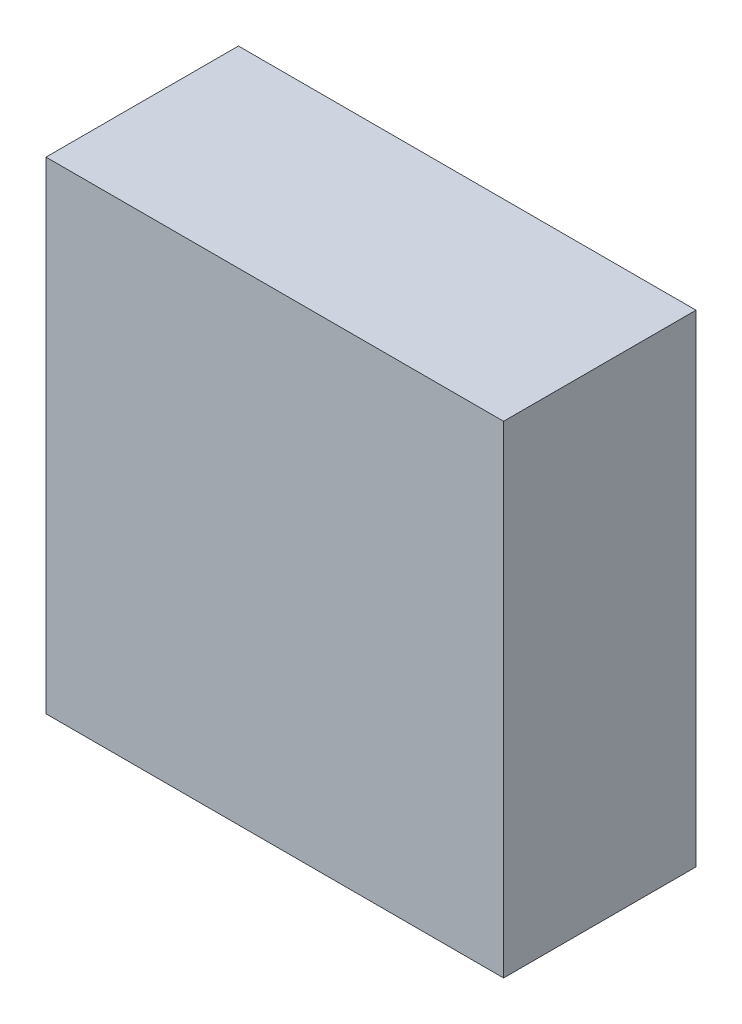
from build123d import *

# Parameters (mm, degrees)
SKETCH1_W               = 9.3955108
SKETCH1_H               = 9.9000056
COMPONENT_OUTLINE_DEPTH = 3.9509446


with BuildPart() as part:
    # Sketch1 → Component_Outline (new body)
    with BuildSketch(Plane.XY):
        with Locations((-4.0386, 0.0029972)):
            Rectangle(SKETCH1_W, SKETCH1_H)
    extrude(amount=COMPONENT_OUTLINE_DEPTH)


solid = part.part
